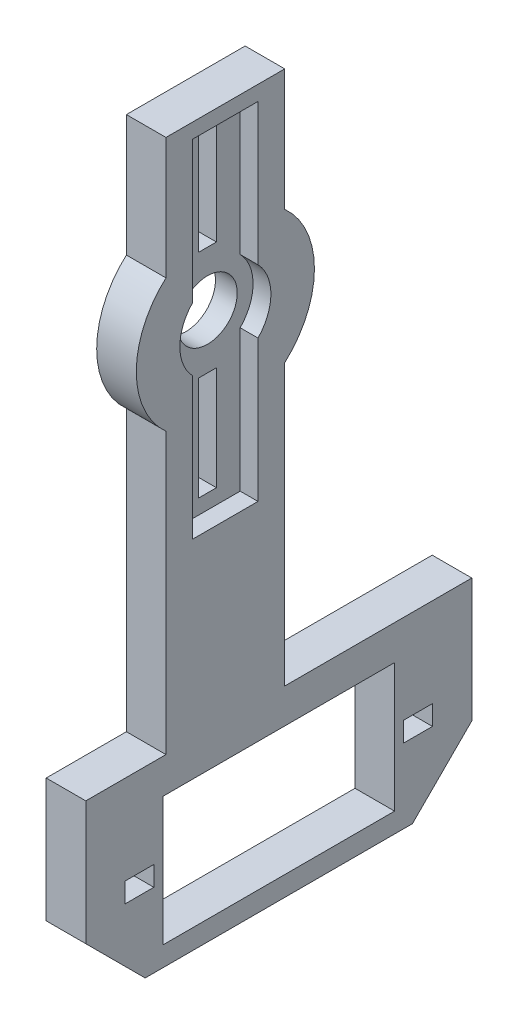
from build123d import *

# Parameters (mm, degrees)
BOSS_EXTRUDE1_START  = -70.4
SKETCH1_R            = 9
BOSS_EXTRUDE1_DEPTH  = 4
BOSS_EXTRUDE2_START  = -58
SKETCH2_W            = 4
SKETCH2_H            = 55
BOSS_EXTRUDE2_DEPTH  = 12
BOSS_EXTRUDE3_START  = -76.9
SKETCH3_W            = 4
SKETCH3_H            = 18.5
BOSS_EXTRUDE3_DEPTH  = 39
BOSS_EXTRUDE4_START  = -71.4
BOSS_EXTRUDE4_DEPTH  = 6
BOSS_EXTRUDE5_START  = -71.4
BOSS_EXTRUDE5_DEPTH  = 6
BOSS_EXTRUDE6_START  = -68.2
SKETCH6_R            = 4.6
BOSS_EXTRUDE6_DEPTH  = 2.3
BOSS_EXTRUDE7_START  = -55.3
SKETCH7_W            = 2.3
SKETCH7_H            = 17.5
BOSS_EXTRUDE7_DEPTH  = 6.6
BOSS_EXTRUDE8_START  = -52.9
SKETCH8_W            = 6
SKETCH8_H            = 10.5
BOSS_EXTRUDE8_DEPTH  = 1.8
BOSS_EXTRUDE9_START  = -55.3
SKETCH9_W            = 2.3
SKETCH9_H            = 17.5
BOSS_EXTRUDE9_DEPTH  = 6.6
BOSS_EXTRUDE10_START = -52.9
SKETCH10_W           = 6
SKETCH10_H           = 10.5
BOSS_EXTRUDE10_DEPTH = 1.8
BOSS_EXTRUDE11_START = -71.4
SKETCH11_R           = 3
BOSS_EXTRUDE11_DEPTH = 6
BOSS_EXTRUDE12_START = -69.1
SKETCH12_W           = 6
SKETCH12_H           = 13
BOSS_EXTRUDE12_DEPTH = 23.4
BOSS_EXTRUDE13_START = -72.925
SKETCH13_W           = 6
SKETCH13_H           = 2
BOSS_EXTRUDE13_DEPTH = 2.9
BOSS_EXTRUDE14_START = -44.775
SKETCH14_W           = 6
SKETCH14_H           = 2
BOSS_EXTRUDE14_DEPTH = 2.9


with BuildPart() as part:
    # Sketch1 → Boss-Extrude1 (new body)
    with BuildSketch(Plane(origin=(0, 0, 0), x_dir=(0, 0, -1), z_dir=(1, 0, 0)).offset(BOSS_EXTRUDE1_START)):
        with Locations((52, -20)):
            Circle(SKETCH1_R)
    extrude(amount=BOSS_EXTRUDE1_DEPTH)

    # Sketch2 → Boss-Extrude2 (add)
    with BuildSketch(Plane.XY.offset(BOSS_EXTRUDE2_START)):
        with Locations((-68.4, -28.5)):
            Rectangle(SKETCH2_W, SKETCH2_H)
    extrude(amount=BOSS_EXTRUDE2_DEPTH)

    # Sketch3 → Boss-Extrude3 (add)
    with BuildSketch(Plane.XY.offset(BOSS_EXTRUDE3_START)):
        with Locations((-68.4, -64.25)):
            Rectangle(SKETCH3_W, SKETCH3_H)
    extrude(amount=BOSS_EXTRUDE3_DEPTH)


with BuildPart() as body_2:
    # Sketch4 → Boss-Extrude4 (new body)
    with BuildSketch(Plane(origin=(0, 0, 0), x_dir=(0, 0, -1), z_dir=(1, 0, 0)).offset(BOSS_EXTRUDE4_START)):
        Polygon((36.9, -74.5), (44.9, -74.5), (36.9, -66.5), align=None)
    extrude(amount=BOSS_EXTRUDE4_DEPTH)


with BuildPart() as part_1:
    add(part.part)

    # Combine1: cut body 2
    add(body_2.part, mode=Mode.SUBTRACT)


with BuildPart() as body_2_2:
    # Sketch5 → Boss-Extrude5 (new body)
    with BuildSketch(Plane(origin=(0, 0, 0), x_dir=(0, 0, -1), z_dir=(1, 0, 0)).offset(BOSS_EXTRUDE5_START)):
        Polygon((77.9, -74.5), (69.9, -74.5), (77.9, -66.5), align=None)
    extrude(amount=BOSS_EXTRUDE5_DEPTH)


with BuildPart() as part_2:
    add(part_1.part)

    # Combine2: cut body 2 2
    add(body_2_2.part, mode=Mode.SUBTRACT)


with BuildPart() as body_2_3:
    # Sketch6 → Boss-Extrude6 (new body)
    with BuildSketch(Plane(origin=(0, 0, 0), x_dir=(0, 0, -1), z_dir=(1, 0, 0)).offset(BOSS_EXTRUDE6_START)):
        with Locations((52, -20)):
            Circle(SKETCH6_R)
    extrude(amount=BOSS_EXTRUDE6_DEPTH)


with BuildPart() as part_3:
    add(part_2.part)

    # Combine3: cut body 2 3
    add(body_2_3.part, mode=Mode.SUBTRACT)


with BuildPart() as body_2_4:
    # Sketch7 → Boss-Extrude7 (new body)
    with BuildSketch(Plane.XY.offset(BOSS_EXTRUDE7_START)):
        with Locations((-67.05, -11.25)):
            Rectangle(SKETCH7_W, SKETCH7_H)
    extrude(amount=BOSS_EXTRUDE7_DEPTH)


with BuildPart() as part_4:
    add(part_3.part)

    # Combine4: cut body 2 4
    add(body_2_4.part, mode=Mode.SUBTRACT)


with BuildPart() as body_2_5:
    # Sketch8 → Boss-Extrude8 (new body)
    with BuildSketch(Plane.XY.offset(BOSS_EXTRUDE8_START)):
        with Locations((-68.4, -9.25)):
            Rectangle(SKETCH8_W, SKETCH8_H)
    extrude(amount=BOSS_EXTRUDE8_DEPTH)


with BuildPart() as part_5:
    add(part_4.part)

    # Combine5: cut body 2 5
    add(body_2_5.part, mode=Mode.SUBTRACT)


with BuildPart() as body_2_6:
    # Sketch9 → Boss-Extrude9 (new body)
    with BuildSketch(Plane.XY.offset(BOSS_EXTRUDE9_START)):
        with Locations((-67.05, -28.75)):
            Rectangle(SKETCH9_W, SKETCH9_H)
    extrude(amount=BOSS_EXTRUDE9_DEPTH)


with BuildPart() as part_6:
    add(part_5.part)

    # Combine6: cut body 2 6
    add(body_2_6.part, mode=Mode.SUBTRACT)


with BuildPart() as body_2_7:
    # Sketch10 → Boss-Extrude10 (new body)
    with BuildSketch(Plane.XY.offset(BOSS_EXTRUDE10_START)):
        with Locations((-68.4, -30.75)):
            Rectangle(SKETCH10_W, SKETCH10_H)
    extrude(amount=BOSS_EXTRUDE10_DEPTH)


with BuildPart() as part_7:
    add(part_6.part)

    # Combine7: cut body 2 7
    add(body_2_7.part, mode=Mode.SUBTRACT)


with BuildPart() as body_2_8:
    # Sketch11 → Boss-Extrude11 (new body)
    with BuildSketch(Plane(origin=(0, 0, 0), x_dir=(0, 0, -1), z_dir=(1, 0, 0)).offset(BOSS_EXTRUDE11_START)):
        with Locations((52, -20)):
            Circle(SKETCH11_R)
    extrude(amount=BOSS_EXTRUDE11_DEPTH)


with BuildPart() as part_8:
    add(part_7.part)

    # Combine8: cut body 2 8
    add(body_2_8.part, mode=Mode.SUBTRACT)


with BuildPart() as body_2_9:
    # Sketch12 → Boss-Extrude12 (new body)
    with BuildSketch(Plane.XY.offset(BOSS_EXTRUDE12_START)):
        with Locations((-68.4, -65)):
            Rectangle(SKETCH12_W, SKETCH12_H)
    extrude(amount=BOSS_EXTRUDE12_DEPTH)


with BuildPart() as part_9:
    add(part_8.part)

    # Combine9: cut body 2 9
    add(body_2_9.part, mode=Mode.SUBTRACT)


with BuildPart() as body_2_10:
    # Sketch13 → Boss-Extrude13 (new body)
    with BuildSketch(Plane.XY.offset(BOSS_EXTRUDE13_START)):
        with Locations((-68.4, -65)):
            Rectangle(SKETCH13_W, SKETCH13_H)
    extrude(amount=BOSS_EXTRUDE13_DEPTH)


with BuildPart() as part_10:
    add(part_9.part)

    # Combine10: cut body 2 10
    add(body_2_10.part, mode=Mode.SUBTRACT)


with BuildPart() as body_2_11:
    # Sketch14 → Boss-Extrude14 (new body)
    with BuildSketch(Plane.XY.offset(BOSS_EXTRUDE14_START)):
        with Locations((-68.4, -65)):
            Rectangle(SKETCH14_W, SKETCH14_H)
    extrude(amount=BOSS_EXTRUDE14_DEPTH)


with BuildPart() as part_11:
    add(part_10.part)

    # Combine11: cut body 2 11
    add(body_2_11.part, mode=Mode.SUBTRACT)


solid = part_11.part
